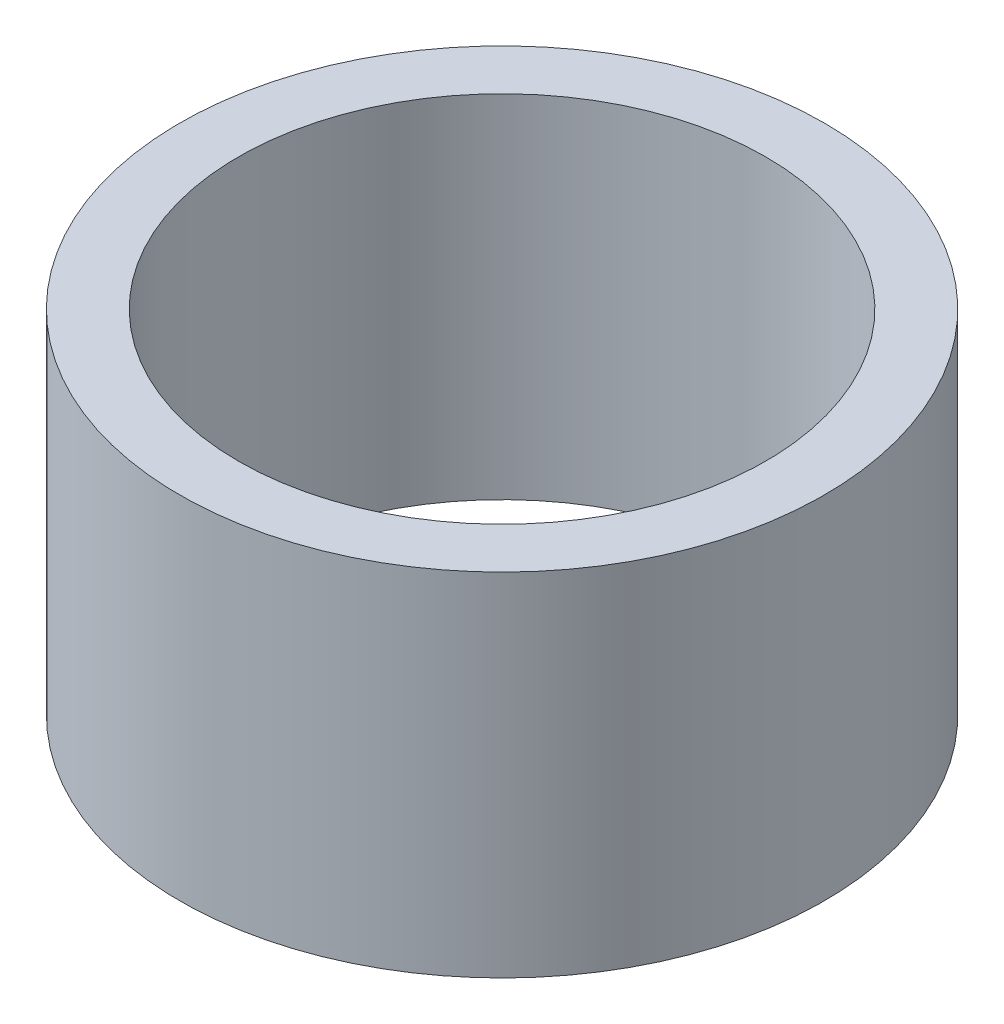
from build123d import *

# Parameters (mm, degrees)
SKETCH1_R           = 17.4625
SKETCH1_R_2         = 14.2875
BOSS_EXTRUDE1_DEPTH = 19.05


with BuildPart() as part:
    # Sketch1 → Boss-Extrude1 (new body)
    with BuildSketch(Plane(origin=(0, 0, 0), x_dir=(-1, 0, 0), z_dir=(0, 1, 0))):
        with Locations(Location((0, 0, 0), (0, 0, 270))):
            Circle(SKETCH1_R)
        with Locations(Location((0, 0, 0), (0, 0, 270))):
            Circle(SKETCH1_R_2, mode=Mode.SUBTRACT)
    extrude(amount=BOSS_EXTRUDE1_DEPTH)


solid = part.part
